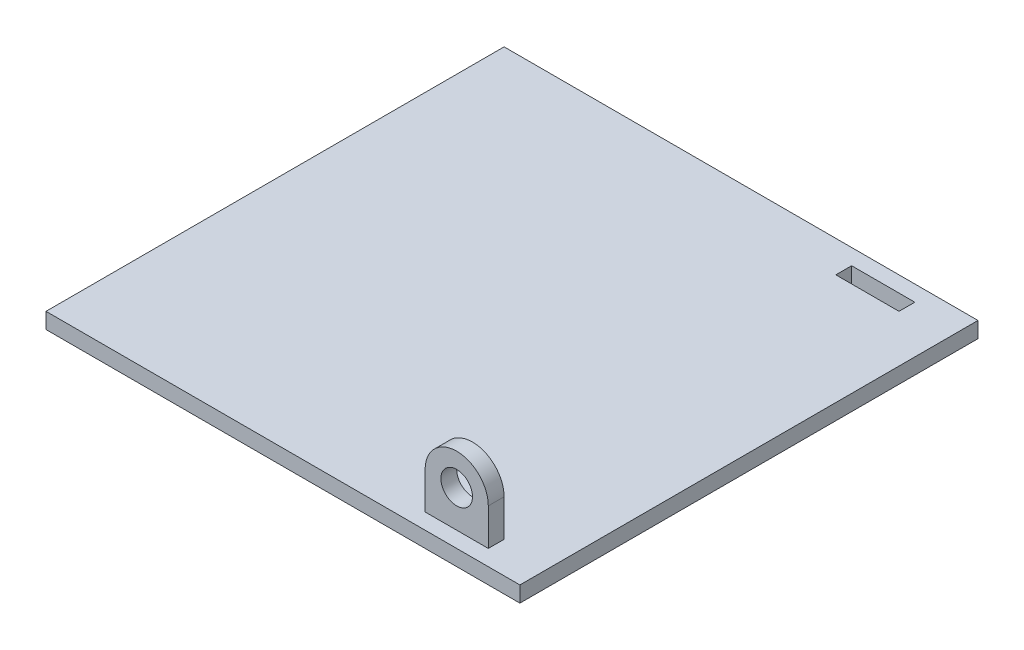
from build123d import *

# Parameters (mm, degrees)
SKETCH1_W           = 90
SKETCH1_H           = 87
SKETCH1_W_2         = 12
SKETCH1_H_2         = 3
BOSS_EXTRUDE1_DEPTH = 3
SKETCH3_R           = 3
BOSS_EXTRUDE2_DEPTH = 3


with BuildPart() as part:
    # Sketch1 → Boss-Extrude1 (new body)
    with BuildSketch(Plane(origin=(0, 0, 0), x_dir=(1, 0, 0), z_dir=(0, 1, 0))):
        Rectangle(SKETCH1_W, SKETCH1_H)
        with Locations((30, 39)):
            Rectangle(SKETCH1_W_2, SKETCH1_H_2, mode=Mode.SUBTRACT)
    extrude(amount=BOSS_EXTRUDE1_DEPTH)

    # Sketch3 → Boss-Extrude2 (add)
    with BuildSketch(Plane.XY.offset(40.5)):
        with BuildLine():
            Line((24, 3), (24, 10))
            ThreePointArc((24, 10), (30, 16), (36, 10))
            Line((36, 10), (36, 3))
            Line((36, 3), (24, 3))
        make_face()
        with Locations((30, 10)):
            Circle(SKETCH3_R, mode=Mode.SUBTRACT)
    extrude(amount=-BOSS_EXTRUDE2_DEPTH)


solid = part.part
